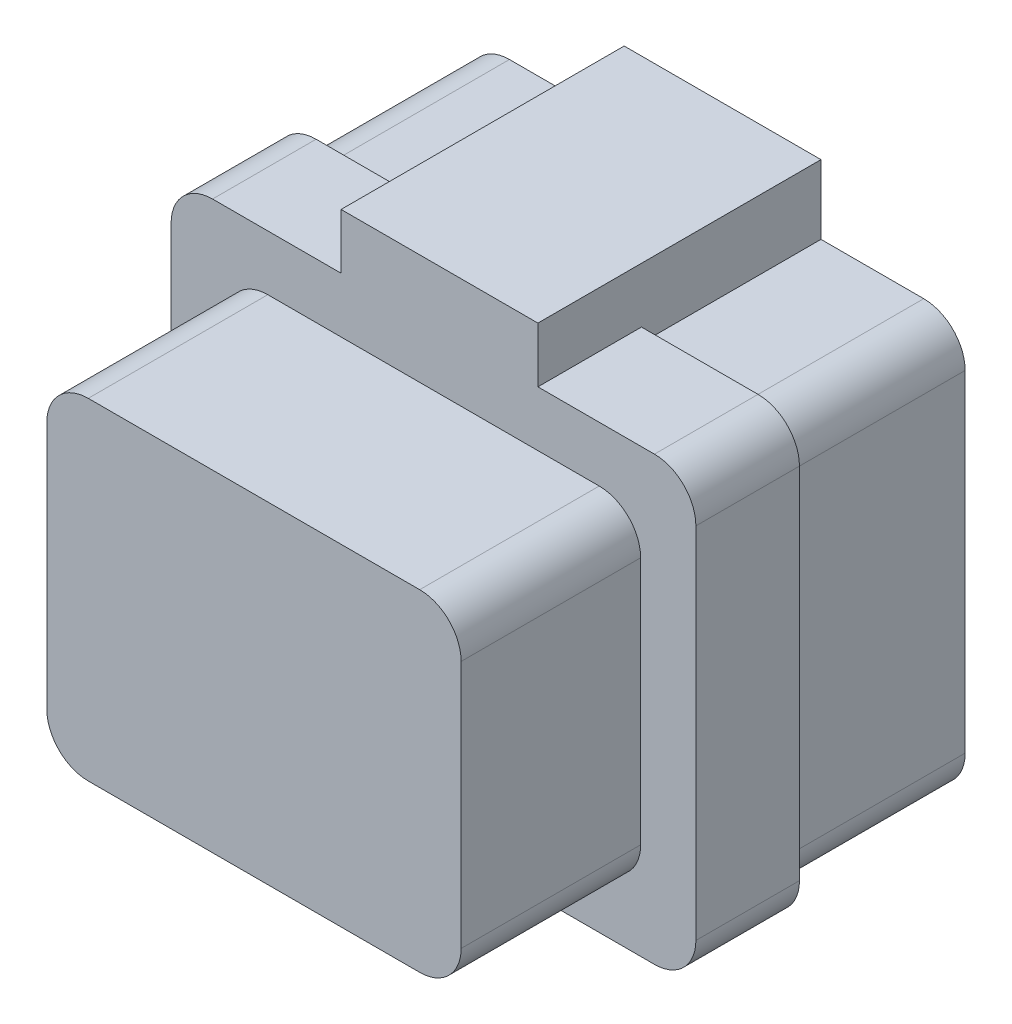
from build123d import *

# Parameters (mm, degrees)
SKETCH_1_W          = 38
SKETCH_1_H          = 32
EXTRUDE_1_DEPTH     = 7.5
SKETCH_2_W          = 30
SKETCH_2_H          = 24
EXTRUDE_2_DEPTH     = 13
SKETCH_3_W          = 36
SKETCH_3_H          = 30
EXTRUDE_3_DEPTH     = 13
FILLET_1_R          = 3
SKETCH_4_W          = 14.251967781
SKETCH_4_H          = 20.5
EXTRUDE_4_DEPTH     = 5
SKETCH_5_R          = 10.910611056
CUT_EXTRUDE_1_DEPTH = 1


with BuildPart() as part:
    # ｽｹｯﾁ1 → ﾎﾞｽ - 押し出し1 (new body)
    with BuildSketch(Plane.XY):
        with Locations((19, 16)):
            Rectangle(SKETCH_1_W, SKETCH_1_H)
    extrude(amount=EXTRUDE_1_DEPTH)

    # ｽｹｯﾁ2 → ﾎﾞｽ - 押し出し2 (add)
    with BuildSketch(Plane.XY.offset(7.5)):
        with Locations((19, 16)):
            Rectangle(SKETCH_2_W, SKETCH_2_H)
    extrude(amount=EXTRUDE_2_DEPTH)

    # ｽｹｯﾁ3 → ﾎﾞｽ - 押し出し3 (add)
    with BuildSketch(Plane(origin=(0, 0, 0), x_dir=(-1, 0, 0), z_dir=(0, 0, -1))):
        with Locations((-19, 16)):
            Rectangle(SKETCH_3_W, SKETCH_3_H)
    extrude(amount=EXTRUDE_3_DEPTH)

    # ﾌｨﾚｯﾄ1
    fillet_1_edges = [part.edges().sort_by_distance(p)[0] for p in [
        (34, 28, 14),
        (4, 28, 14),
        (4, 4, 14),
        (34, 4, 14),
        (37, 1, -6.5),
        (1, 1, -6.5),
        (1, 31, -6.5),
        (37, 31, -6.5),
        (0, 32, 3.75),
        (38, 32, 3.75),
        (38, 0, 3.75),
        (0, 0, 3.75),
    ]]
    fillet(fillet_1_edges, radius=FILLET_1_R)

    # ｽｹｯﾁ4 → ﾎﾞｽ - 押し出し4 (add)
    with BuildSketch(Plane(origin=(0, 31, 0), x_dir=(1, 0, 0), z_dir=(0, 1, 0))):
        with Locations((19.433755542, 2.75)):
            Rectangle(SKETCH_4_W, SKETCH_4_H)
    extrude(amount=EXTRUDE_4_DEPTH)

    # ｽｹｯﾁ5 → ｶｯﾄ - 押し出し1 (cut)
    with BuildSketch(Plane(origin=(0, 0, -13), x_dir=(-1, 0, 0), z_dir=(0, 0, -1))):
        with Locations((-19.433755541, 18.5)):
            Circle(SKETCH_5_R)
    extrude(amount=-CUT_EXTRUDE_1_DEPTH, mode=Mode.SUBTRACT)


solid = part.part
